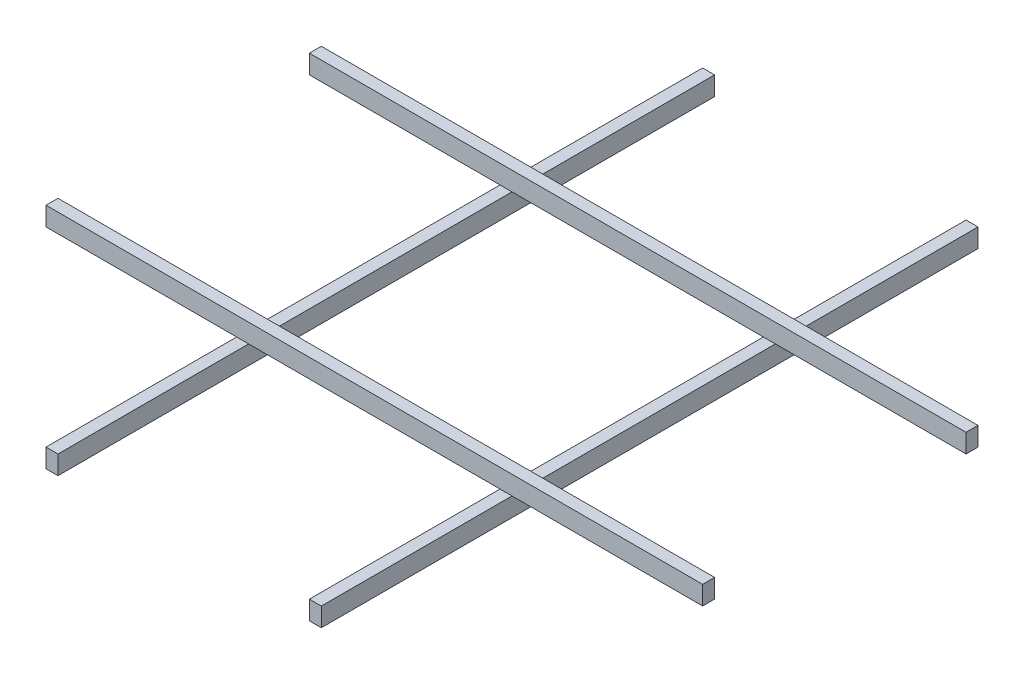
from build123d import *

# Parameters (mm, degrees)
SKETCH1_W              = 88.9
SKETCH1_H              = 139.7
PROFILES_4X6_1_DEPTH   = 4876.8
SKETCH1_ON_SEGMENT_2_W = 88.9
SKETCH1_ON_SEGMENT_2_H = 139.7
PROFILES_4X6_1_2_DEPTH = 4876.8
SKETCH1_ON_SEGMENT_3_W = 88.9
SKETCH1_ON_SEGMENT_3_H = 139.7
PROFILES_4X6_1_3_DEPTH = 4876.8
SKETCH1_ON_SEGMENT_4_W = 88.9
SKETCH1_ON_SEGMENT_4_H = 139.7
PROFILES_4X6_1_4_DEPTH = 4876.8


with BuildPart() as part:
    # Sketch1 → Profiles 4X6(1) (new body)
    with BuildSketch(Plane(origin=(1155.7, 0, 0), x_dir=(-1, 0, 0), z_dir=(0, 0, -1))):
        Rectangle(SKETCH1_W, SKETCH1_H)
    extrude(amount=PROFILES_4X6_1_DEPTH)


with BuildPart() as body_2:
    # Sketch1 on segment 2 (carried to segment 2) → Profiles 4X6_1 2 (new body)
    with BuildSketch(Plane(origin=(3111.5, 0, 0), x_dir=(-1, 0, 0), z_dir=(0, 0, -1))):
        Rectangle(SKETCH1_ON_SEGMENT_2_W, SKETCH1_ON_SEGMENT_2_H)
    extrude(amount=PROFILES_4X6_1_2_DEPTH)


with BuildPart() as body_3:
    # Sketch1 on segment 3 (carried to segment 3) → Profiles 4X6_1 3 (new body)
    with BuildSketch(Plane(origin=(-304.8, 139.7, -3416.3), x_dir=(0, 0, -1), z_dir=(1, 0, 0))):
        Rectangle(SKETCH1_ON_SEGMENT_3_W, SKETCH1_ON_SEGMENT_3_H)
    extrude(amount=PROFILES_4X6_1_3_DEPTH)


with BuildPart() as body_4:
    # Sketch1 on segment 4 (carried to segment 4) → Profiles 4X6_1 4 (new body)
    with BuildSketch(Plane(origin=(4572, 139.7, -1460.5), x_dir=(0, 0, 1), z_dir=(-1, 0, 0))):
        Rectangle(SKETCH1_ON_SEGMENT_4_W, SKETCH1_ON_SEGMENT_4_H)
    extrude(amount=PROFILES_4X6_1_4_DEPTH)


solid = Compound([part.part, body_2.part, body_3.part, body_4.part])
